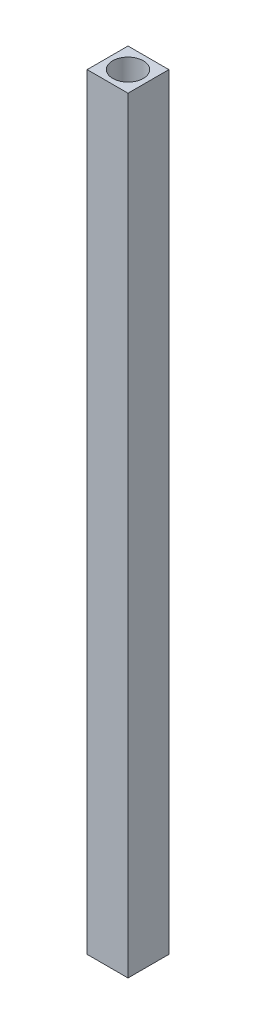
from build123d import *

# Parameters (mm, degrees)
SKETCH_1_W      = 8
SKETCH_1_H      = 8
SKETCH_1_R      = 3
EXTRUDE_1_DEPTH = 150


with BuildPart() as part:
    # 草图1 → 凸台-拉伸1 (new body)
    with BuildSketch(Plane(origin=(0, 0, 0), x_dir=(1, 0, 0), z_dir=(0, 1, 0))):
        Rectangle(SKETCH_1_W, SKETCH_1_H)
        with Locations(Location((0, 0, 0), (0, 0, 270))):
            Circle(SKETCH_1_R, mode=Mode.SUBTRACT)
    extrude(amount=EXTRUDE_1_DEPTH)


solid = part.part
